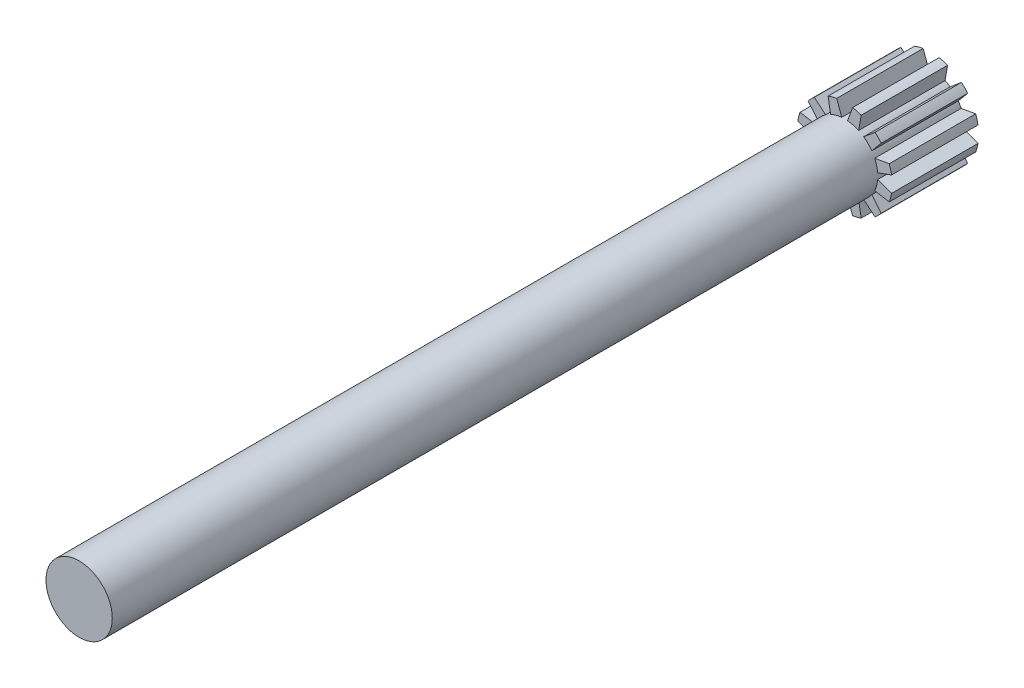
from build123d import *

# Parameters (mm, degrees)
SKETCH1_R           = 57.5
BOSS_EXTRUDE1_DEPTH = 1328
SKETCH3_R           = 82.5
BOSS_EXTRUDE2_DEPTH = 150
CUT_EXTRUDE1_DEPTH  = 150
CIRPATTERN1_COUNT   = 12


with BuildPart() as part:
    # Sketch1 → Boss-Extrude1 (new body)
    with BuildSketch(Plane.XY):
        Circle(SKETCH1_R)
    extrude(amount=BOSS_EXTRUDE1_DEPTH)

    # Sketch3 → Boss-Extrude2 (add)
    with BuildSketch(Plane(origin=(0, 0, 0), x_dir=(-1, 0, 0), z_dir=(0, 0, -1))):
        Circle(SKETCH3_R)
    extrude(amount=BOSS_EXTRUDE2_DEPTH)

    # Sketch5 → Cut-Extrude1 (cut)
    with BuildSketch(Plane(origin=(0, 0, -150), x_dir=(-1, 0, 0), z_dir=(0, 0, -1))):
        with BuildLine():
            Line((-13.805552215, 81.336687467), (-5.048873049, 57.277909188))
            ThreePointArc((-5.048873049, 57.277909188), (0, 57.5), (5.048873049, 57.277909188))
            Line((5.048873049, 57.277909188), (13.805552215, 81.336687467))
            ThreePointArc((13.805552215, 81.336687467), (0, 82.5), (-13.805552215, 81.336687467))
        make_face()
    cut_extrude1 = extrude(amount=-CUT_EXTRUDE1_DEPTH, mode=Mode.SUBTRACT)

    # CirPattern1: Cut-Extrude1 ×12 about axis
    cirpattern1_axis = Axis((0, 0, 0), (0, 0, 1))
    for i in range(1, CIRPATTERN1_COUNT):
        add(cut_extrude1.rotate(cirpattern1_axis, i * 360 / CIRPATTERN1_COUNT), mode=Mode.SUBTRACT)


solid = part.part
